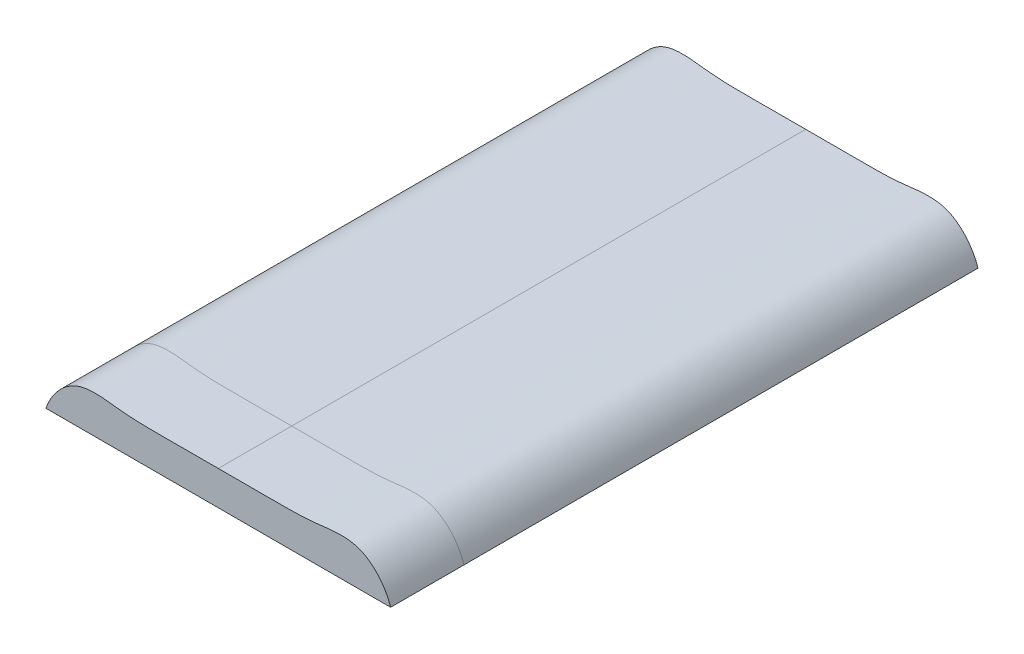
from build123d import *

# Parameters (mm, degrees)
CORPO_DA_TAMPA_DEPTH = 105
TAMPA_SUPERIOR_DEPTH = 15


with BuildPart() as part:
    # Forma Principal → Corpo da Tampa (new body)
    with BuildSketch(Plane.XY):
        with BuildLine():
            Line((20.2, -12.030151519), (20.2, -10.030151519))
            Line((20.2, -10.030151519), (-20.2, -10.030151519))
            Line((-20.2, -10.030151519), (-20.2, -12.030151519))
            Line((-20.2, -12.030151519), (-18.71507576, -13.51507576))
            Line((-18.71507576, -13.51507576), (-20.2, -15))
            Line((-20.2, -15), (-35.2, -15))
            add(Edge.make_bspline(
                [(-35.2, -15), (-34.280475344, -12.093745364), (-29.42443277, -5.970228208), (-20.594092613, -7.920417436), (-11.051499012, -8.103133806), (-4.637412791, -7.987592699), (0, -8.030151519)],
                knots=[0, 0, 0, 0, 0.248741102, 0.507769796, 0.63738037, 1, 1, 1, 1], degree=3))
            add(Edge.make_bspline(
                [(35.2, -15), (34.280475344, -12.093745364), (29.42443277, -5.970228208), (20.594092613, -7.920417436), (11.051499012, -8.103133806), (4.637412791, -7.987592699), (0, -8.030151519)],
                knots=[0, 0, 0, 0, 0.248741102, 0.507769796, 0.63738037, 1, 1, 1, 1], degree=3))
            Line((35.2, -15), (20.2, -15))
            Line((20.2, -15), (18.71507576, -13.51507576))
            Line((18.71507576, -13.51507576), (20.2, -12.030151519))
        make_face()
    extrude(amount=CORPO_DA_TAMPA_DEPTH)

    # Esboço4 → Tampa Superior (add)
    with BuildSketch(Plane.XY.offset(105)):
        with BuildLine():
            Line((-35.2, -15), (35.2, -15))
            add(Edge.make_bspline(
                [(35.2, -15), (34.280475344, -12.093744684), (29.42443277, -5.97023045), (20.594092612, -7.920411928), (11.051499009, -8.103149978), (4.637412781, -7.987486804), (0, -8.030517111)],
                knots=[0, 0, 0, 0, 0.248741102, 0.507769796, 0.63738037, 1, 1, 1, 1], degree=3))
            add(Edge.make_bspline(
                [(-35.2, -15), (-34.280475344, -12.093744684), (-29.42443277, -5.97023045), (-20.594092612, -7.920411928), (-11.051499009, -8.103149978), (-4.637412781, -7.987486804), (0, -8.030517111)],
                knots=[0, 0, 0, 0, 0.248741102, 0.507769796, 0.63738037, 1, 1, 1, 1], degree=3))
        make_face()
    extrude(amount=TAMPA_SUPERIOR_DEPTH)


solid = part.part
